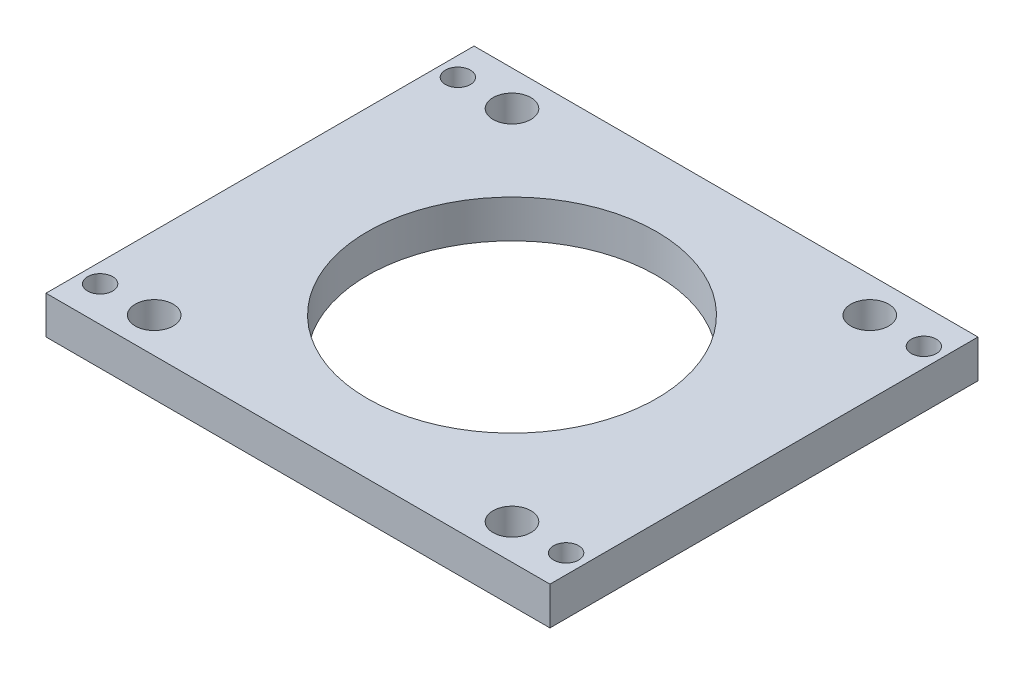
from build123d import *

# Parameters (mm, degrees)
SZKIC1_W                    = 66.4
SZKIC1_H                    = 56.4
SZKIC1_R                    = 19.05
SZKIC1_R_2                  = 2.5
DODANIE_WYCI_GNI_CIE1_DEPTH = 5
OTW_R_GWINTOWANY_M41_D      = 3.3
OTW_R_GWINTOWANY_M42_D      = 3.3


with BuildPart() as part:
    # Szkic1 → Dodanie-wyciągnięcie1 (new body)
    with BuildSketch(Plane(origin=(0, 0, 0), x_dir=(1, 0, 0), z_dir=(0, 1, 0))):
        with Locations((33.2, 28.2)):
            Rectangle(SZKIC1_W, SZKIC1_H)
        with Locations(Location((33.2, 28.2, 0), (0, 0, 270))):
            Circle(SZKIC1_R, mode=Mode.SUBTRACT)
        with Locations(Location((9.63, 51.77, 0), (0, 0, 270))):
            Circle(SZKIC1_R_2, mode=Mode.SUBTRACT)
        with Locations(Location((56.77, 51.77, 0), (0, 0, 90))):
            Circle(SZKIC1_R_2, mode=Mode.SUBTRACT)
        with Locations(Location((56.77, 4.63, 0), (0, 0, 270))):
            Circle(SZKIC1_R_2, mode=Mode.SUBTRACT)
        with Locations(Location((9.63, 4.63, 0), (0, 0, 90))):
            Circle(SZKIC1_R_2, mode=Mode.SUBTRACT)
    extrude(amount=DODANIE_WYCI_GNI_CIE1_DEPTH)

    # Otwór gwintowany M41 (through all)
    with Locations(Plane(origin=(2.5, 5, -51.77), x_dir=(0, 0, 1), z_dir=(0, 1, 0))):
        with Locations((0, 0)):
            Hole(OTW_R_GWINTOWANY_M41_D / 2)

    # Otwór gwintowany M42 (through all)
    with Locations(Plane(origin=(63.9, 5, -51.77), x_dir=(0, 0, 1), z_dir=(0, 1, 0))):
        with Locations((0, 0), (47.14, 0), (47.14, -61.4)):
            Hole(OTW_R_GWINTOWANY_M42_D / 2)


solid = part.part
